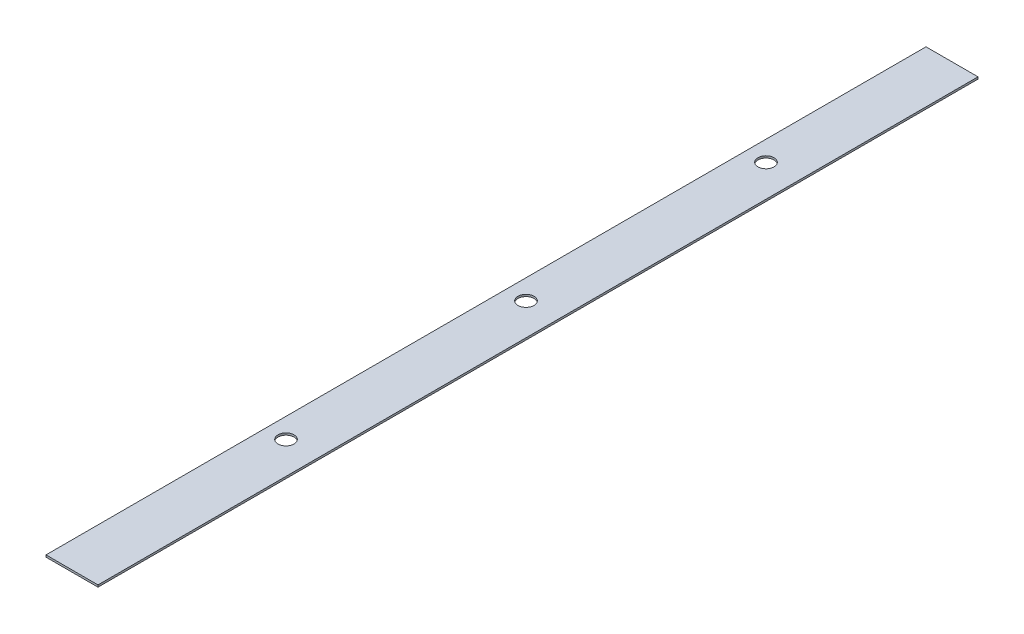
from build123d import *

# Parameters (mm, degrees)
ESQUISSE1_W             = 13
ESQUISSE1_H             = 0.5
BOSS_EXTRU_1_DEPTH      = 220
ENL_V_MAT_EXTRU_1_REACH = 222.384
ESQUISSE2_R             = 2


with BuildPart() as part:
    # Esquisse1 → Boss.-Extru.1 (new body)
    with BuildSketch(Plane.XY):
        with Locations((6.5, 0.25)):
            Rectangle(ESQUISSE1_W, ESQUISSE1_H)
    extrude(amount=BOSS_EXTRU_1_DEPTH)

    # Esquisse2 → Enlèv. mat.-Extru.1 (cut, up to next)
    with BuildSketch(Plane(origin=(0, 0.5, 0), x_dir=(1, 0, 0), z_dir=(0, 1, 0)), mode=Mode.PRIVATE) as enl_v_mat_extru_1_sk1:
        with Locations(Location((5, -45, 0), (0, 0, 270))):
            Circle(ESQUISSE2_R)
    enl_v_mat_extru_1_tool1 = extrude(enl_v_mat_extru_1_sk1.sketch, amount=-ENL_V_MAT_EXTRU_1_REACH, mode=Mode.PRIVATE) & part.part
    # Esquisse2 → Enlèv. mat.-Extru.1 (cut, up to next)
    with BuildSketch(Plane(origin=(0, 0.5, 0), x_dir=(1, 0, 0), z_dir=(0, 1, 0)), mode=Mode.PRIVATE) as enl_v_mat_extru_1_sk2:
        with Locations(Location((5, -105, 0), (0, 0, 270))):
            Circle(ESQUISSE2_R)
    enl_v_mat_extru_1_tool2 = extrude(enl_v_mat_extru_1_sk2.sketch, amount=-ENL_V_MAT_EXTRU_1_REACH, mode=Mode.PRIVATE) & part.part
    # Esquisse2 → Enlèv. mat.-Extru.1 (cut, up to next)
    with BuildSketch(Plane(origin=(0, 0.5, 0), x_dir=(1, 0, 0), z_dir=(0, 1, 0)), mode=Mode.PRIVATE) as enl_v_mat_extru_1_sk3:
        with Locations(Location((5, -165, 0), (0, 0, 270))):
            Circle(ESQUISSE2_R)
    enl_v_mat_extru_1_tool3 = extrude(enl_v_mat_extru_1_sk3.sketch, amount=-ENL_V_MAT_EXTRU_1_REACH, mode=Mode.PRIVATE) & part.part
    add(enl_v_mat_extru_1_tool1.solids().sort_by_distance((5, 0.5, 45))[0], mode=Mode.SUBTRACT)
    add(enl_v_mat_extru_1_tool2.solids().sort_by_distance((5, 0.5, 105))[0], mode=Mode.SUBTRACT)
    add(enl_v_mat_extru_1_tool3.solids().sort_by_distance((5, 0.5, 165))[0], mode=Mode.SUBTRACT)


solid = part.part
